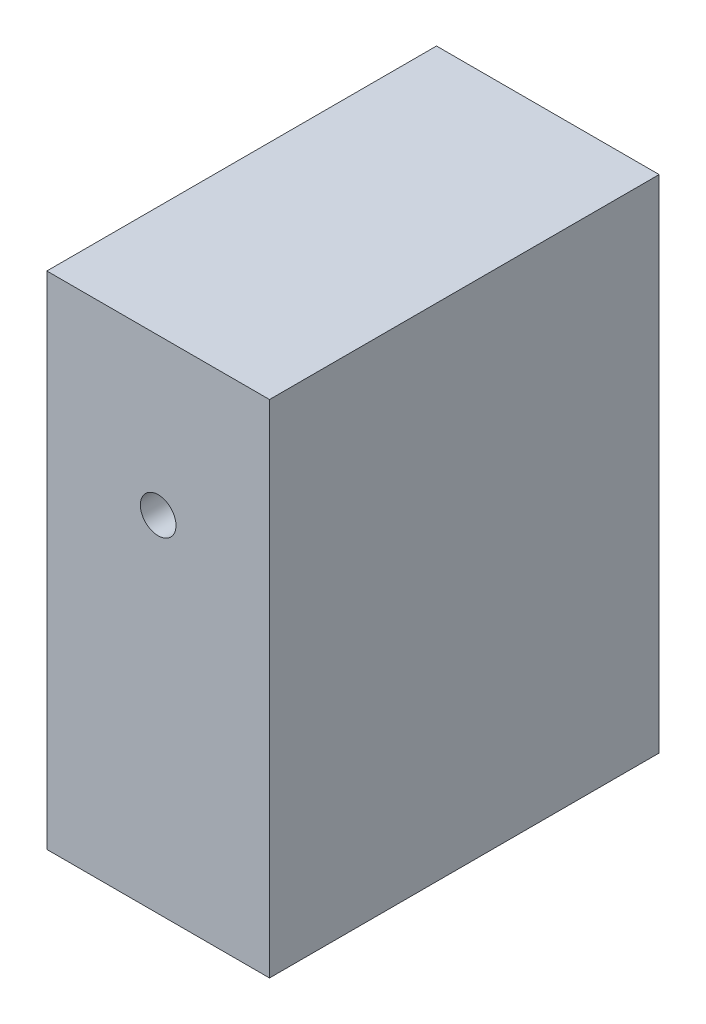
from build123d import *

# Parameters (mm, degrees)
SKETCH_1_W      = 20
SKETCH_1_H      = 45
SKETCH_1_R      = 1.6
EXTRUDE_1_DEPTH = 35


with BuildPart() as part:
    # 草圖1 → 填料-伸長1 (new body)
    with BuildSketch(Plane.XY):
        with Locations((-41.764705882, 30.441176471)):
            Rectangle(SKETCH_1_W, SKETCH_1_H)
        with Locations((-41.764705882, 38.941176471)):
            Circle(SKETCH_1_R, mode=Mode.SUBTRACT)
    extrude(amount=EXTRUDE_1_DEPTH)


solid = part.part
